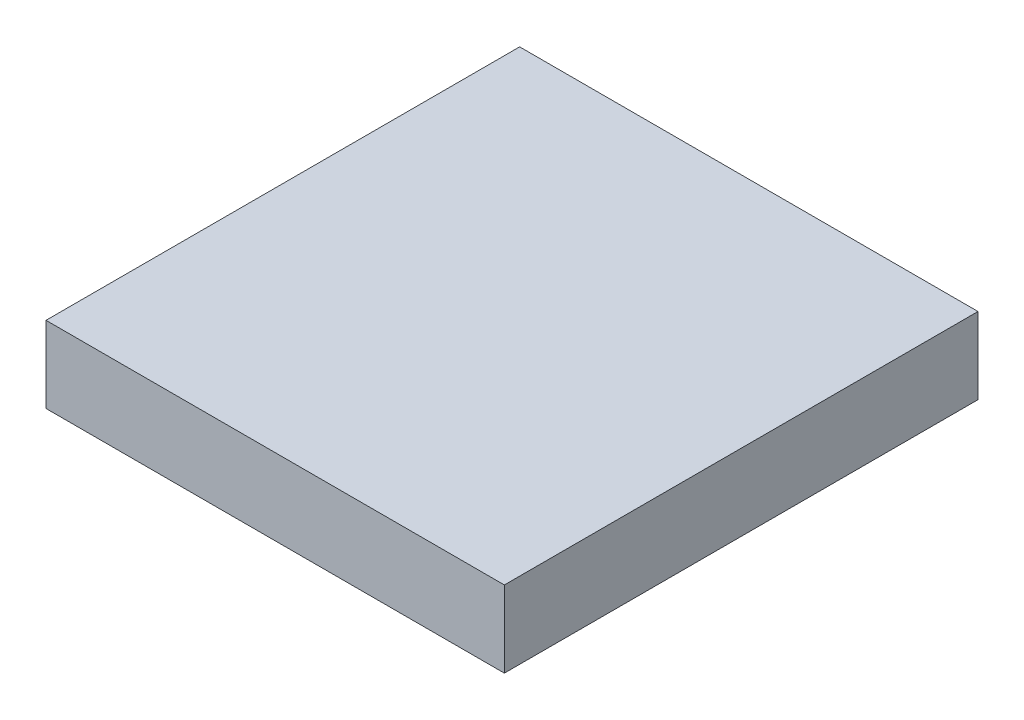
from build123d import *

# Parameters (mm, degrees)
SKETCH1_W           = 38.1
SKETCH1_H           = 39.37
BOSS_EXTRUDE1_DEPTH = 6.35


with BuildPart() as part:
    # Sketch1 → Boss-Extrude1 (new body)
    with BuildSketch(Plane(origin=(0, 0, 0), x_dir=(1, 0, 0), z_dir=(0, 1, 0))):
        Rectangle(SKETCH1_W, SKETCH1_H)
    extrude(amount=BOSS_EXTRUDE1_DEPTH)


solid = part.part
